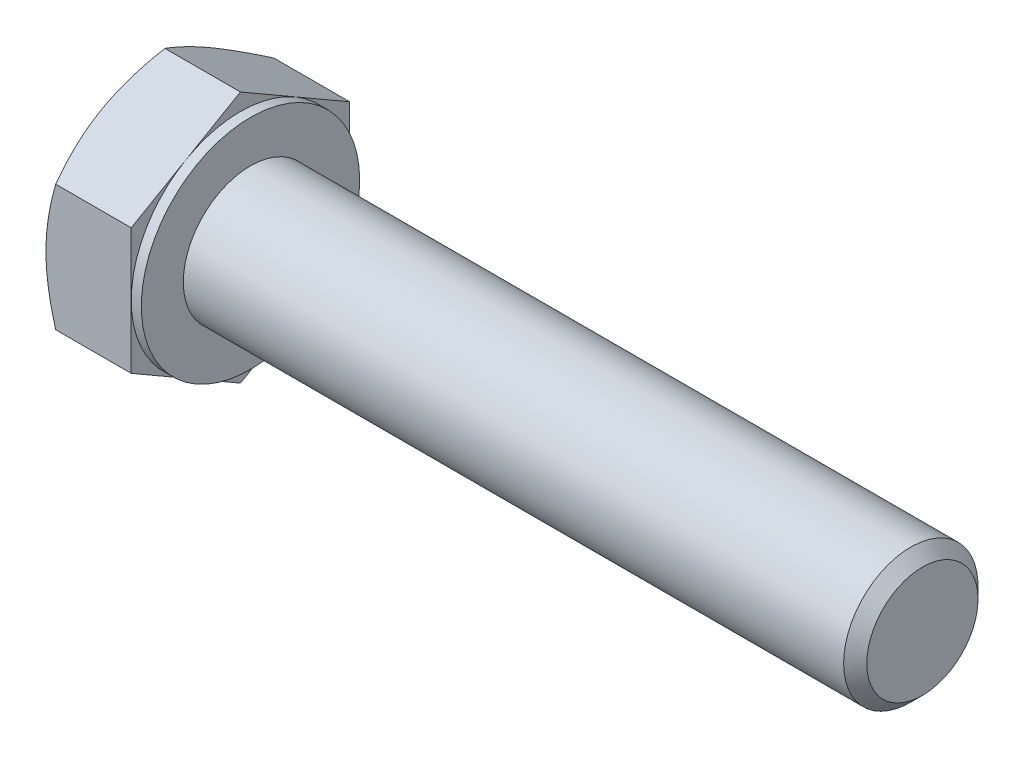
from build123d import *

# Parameters (mm, degrees)
BASEHEAD_DEPTH = 5.675
SKETCH4_W      = 0.6
SKETCH4_H      = 11.005553499


with BuildPart() as part:
    # Sketch1 → BaseHead (new body)
    with BuildSketch(Plane(origin=(0, 0, 0), x_dir=(0, 0, -1), z_dir=(1, 0, 0))):
        Polygon((6.5, 3.75277675), (6.5, -3.75277675), (0, -7.505553499), (-6.5, -3.75277675), (-6.5, 3.75277675), (0, 7.505553499), align=None)
    extrude(amount=BASEHEAD_DEPTH)

    # BodySke → BaseBody (revolve)
    with BuildSketch(Plane.XY, mode=Mode.PRIVATE) as basebody_sk:
        Polygon((0, 0), (45.675, 0), (45.675, 3.3095), (44.9845, 4), (0, 4), align=None)
    revolve(basebody_sk.sketch.rotate(Axis((0, 0, 0), (1, 0, 0)), 90), axis=Axis((0, 0, 0), (1, 0, 0)))

    # Sketch3 → HeadChamfer (revolve, cut)
    with BuildSketch(Plane.XY):
        Polygon((0, 6.5), (3.46730793, 12.505553499), (3.46730793, 17.505553499), (-10, 17.505553499), (-10, 6.5), align=None)
    revolve(axis=Axis((0, 0, 0), (1, 0, 0)), mode=Mode.SUBTRACT)

    # Sketch4 → BearingFace (revolve, cut)
    with BuildSketch(Plane.XY, mode=Mode.PRIVATE) as bearingface_sk:
        with Locations((5.375, 12.00277675)):
            Rectangle(SKETCH4_W, SKETCH4_H)
    revolve(bearingface_sk.sketch.rotate(Axis((0, 0, 0), (1, 0, 0)), 270), axis=Axis((0, 0, 0), (1, 0, 0)), mode=Mode.SUBTRACT)


solid = part.part
